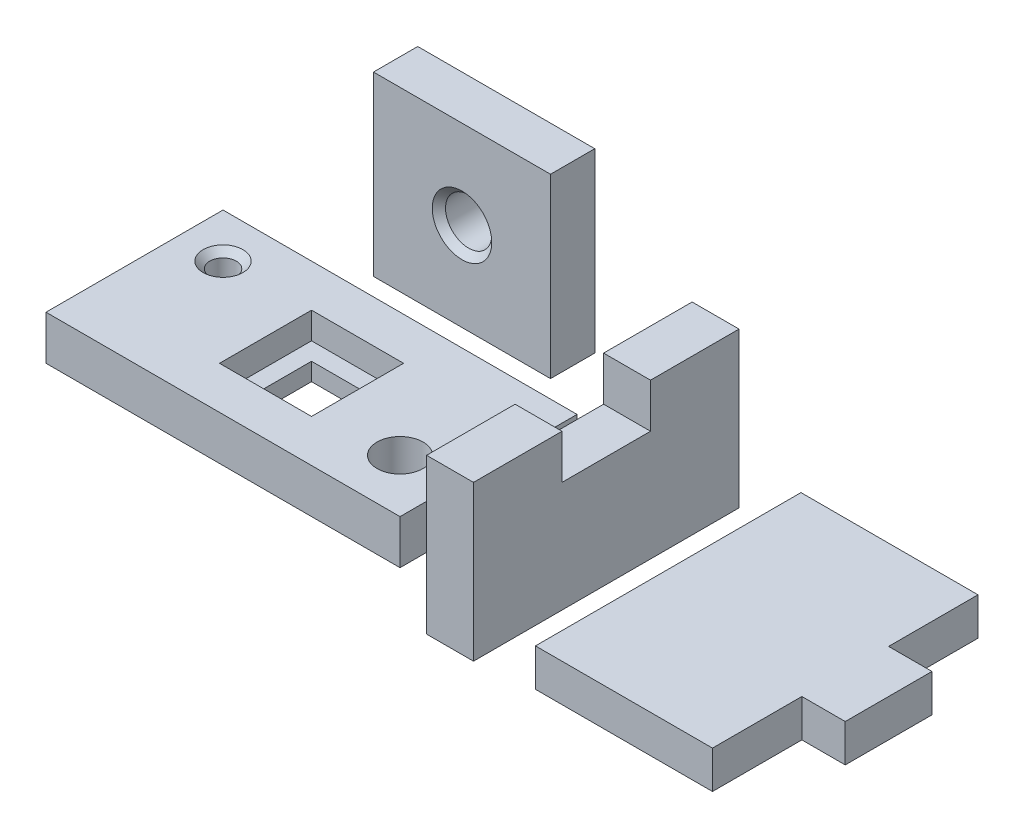
from build123d import *

# Parameters (mm, degrees)
SKETCH1_W           = 40
SKETCH1_H           = 20
BOSS_EXTRUDE1_DEPTH = 5
SKETCH2_R           = 1.5
SKETCH2_R_2         = 2.6
CUT_EXTRUDE1_DEPTH  = 5
CHAMFER1_SIZE       = 0.75
CHAMFER2_SIZE       = 1
SKETCH3_W           = 6.4
SKETCH3_H           = 6.4
CUT_EXTRUDE2_DEPTH  = 5
SKETCH4_W           = 5.298970187
SKETCH4_H           = 30
BOSS_EXTRUDE2_DEPTH = 17.5
SKETCH5_W           = 10
SKETCH5_H           = 10
CUT_EXTRUDE3_DEPTH  = 17.5
SKETCH6_W           = 20
SKETCH6_H           = 30
BOSS_EXTRUDE3_DEPTH = 5
SKETCH7_W           = 4.9
SKETCH7_H           = 9.8
BOSS_EXTRUDE4_DEPTH = 5
SKETCH8_W           = 20
SKETCH8_H           = 5
BOSS_EXTRUDE5_DEPTH = 20
SKETCH9_R           = 2.61
CUT_EXTRUDE4_DEPTH  = 20
CHAMFER4_SIZE       = 0.75
CHAMFER5_SIZE       = 0.75
SKETCH11_W          = 10.4
SKETCH11_H          = 10.4
CUT_EXTRUDE5_DEPTH  = 3


with BuildPart() as part:
    # Sketch1 → Boss-Extrude1 (new body)
    with BuildSketch(Plane(origin=(0, 0, 0), x_dir=(1, 0, 0), z_dir=(0, 1, 0))):
        Rectangle(SKETCH1_W, SKETCH1_H)
    extrude(amount=BOSS_EXTRUDE1_DEPTH)

    # Sketch2 → Cut-Extrude1 (cut)
    with BuildSketch(Plane(origin=(0, 5, 0), x_dir=(1, 0, 0), z_dir=(0, 1, 0))):
        with Locations(Location((-15, 5, 0), (0, 0, 270))):
            Circle(SKETCH2_R)
        with Locations(Location((14, -4, 0), (0, 0, 270))):
            Circle(SKETCH2_R_2)
    extrude(amount=-CUT_EXTRUDE1_DEPTH, mode=Mode.SUBTRACT)

    # Chamfer1
    chamfer1_edges = [part.edges().sort_by_distance(p)[0] for p in [
        (-15, 0, -6.5),
        (-15, 5, -6.5),
    ]]
    chamfer(chamfer1_edges, length=CHAMFER1_SIZE)

    # Chamfer2
    chamfer2_edges = [part.edges().sort_by_distance(p)[0] for p in [
        (14, 0, 1.4),
    ]]
    chamfer(chamfer2_edges, length=CHAMFER2_SIZE)

    # Sketch3 → Cut-Extrude2 (cut)
    with BuildSketch(Plane(origin=(0, 5, 0), x_dir=(1, 0, 0), z_dir=(0, 1, 0))):
        Rectangle(SKETCH3_W, SKETCH3_H)
    extrude(amount=-CUT_EXTRUDE2_DEPTH, mode=Mode.SUBTRACT)

    # Sketch11 → Cut-Extrude5 (cut)
    with BuildSketch(Plane(origin=(0, 5, 0), x_dir=(1, 0, 0), z_dir=(0, 1, 0))):
        Rectangle(SKETCH11_W, SKETCH11_H)
    extrude(amount=-CUT_EXTRUDE5_DEPTH, mode=Mode.SUBTRACT)


with BuildPart() as body_2:
    # Sketch4 → Boss-Extrude2 (new body)
    with BuildSketch(Plane(origin=(0, 0, 0), x_dir=(1, 0, 0), z_dir=(0, 1, 0))):
        with Locations((30.649485094, 0)):
            Rectangle(SKETCH4_W, SKETCH4_H)
    extrude(amount=BOSS_EXTRUDE2_DEPTH)

    # Sketch5 → Cut-Extrude3 (cut)
    with BuildSketch(Plane(origin=(33.298970187, 0, 0), x_dir=(0, 0, -1), z_dir=(1, 0, 0))):
        with Locations((0, 17.5)):
            Rectangle(SKETCH5_W, SKETCH5_H)
    extrude(amount=-CUT_EXTRUDE3_DEPTH, mode=Mode.SUBTRACT)


with BuildPart() as body_3:
    # Sketch6 → Boss-Extrude3 (new body)
    with BuildSketch(Plane(origin=(0, 0, 0), x_dir=(1, 0, 0), z_dir=(0, 1, 0))):
        with Locations((50.298970187, 0)):
            Rectangle(SKETCH6_W, SKETCH6_H)
    extrude(amount=BOSS_EXTRUDE3_DEPTH)

    # Sketch7 → Boss-Extrude4 (add)
    with BuildSketch(Plane(origin=(0, 5, 0), x_dir=(1, 0, 0), z_dir=(0, 1, 0))):
        with Locations((62.748970187, 0)):
            Rectangle(SKETCH7_W, SKETCH7_H)
    extrude(amount=-BOSS_EXTRUDE4_DEPTH)

    # Chamfer4
    chamfer4_edges = [body_3.edges().sort_by_distance(p)[0] for p in [
        (60.298970187, 0, -9.95),
        (62.748970187, 0, -4.9),
        (65.198970187, 0, 0),
        (62.748970187, 0, 4.9),
        (50.298970187, 0, -15),
        (60.298970187, 0, 9.95),
        (50.298970187, 0, 15),
        (40.298970187, 0, 0),
    ]]
    chamfer(chamfer4_edges, length=CHAMFER4_SIZE)


with BuildPart() as body_4:
    # Sketch8 → Boss-Extrude5 (new body)
    with BuildSketch(Plane(origin=(0, 0, 0), x_dir=(1, 0, 0), z_dir=(0, 1, 0))):
        with Locations((0, 19.5)):
            Rectangle(SKETCH8_W, SKETCH8_H)
    extrude(amount=BOSS_EXTRUDE5_DEPTH)

    # Sketch9 → Cut-Extrude4 (cut)
    with BuildSketch(Plane(origin=(0, 0, -22), x_dir=(-1, 0, 0), z_dir=(0, 0, -1))):
        with Locations((0, 10)):
            Circle(SKETCH9_R)
    extrude(amount=-CUT_EXTRUDE4_DEPTH, mode=Mode.SUBTRACT)

    # Chamfer5
    chamfer5_edges = [body_4.edges().sort_by_distance(p)[0] for p in [
        (2.61, 10, -17),
    ]]
    chamfer(chamfer5_edges, length=CHAMFER5_SIZE)


solid = Compound([part.part, body_2.part, body_3.part, body_4.part])
